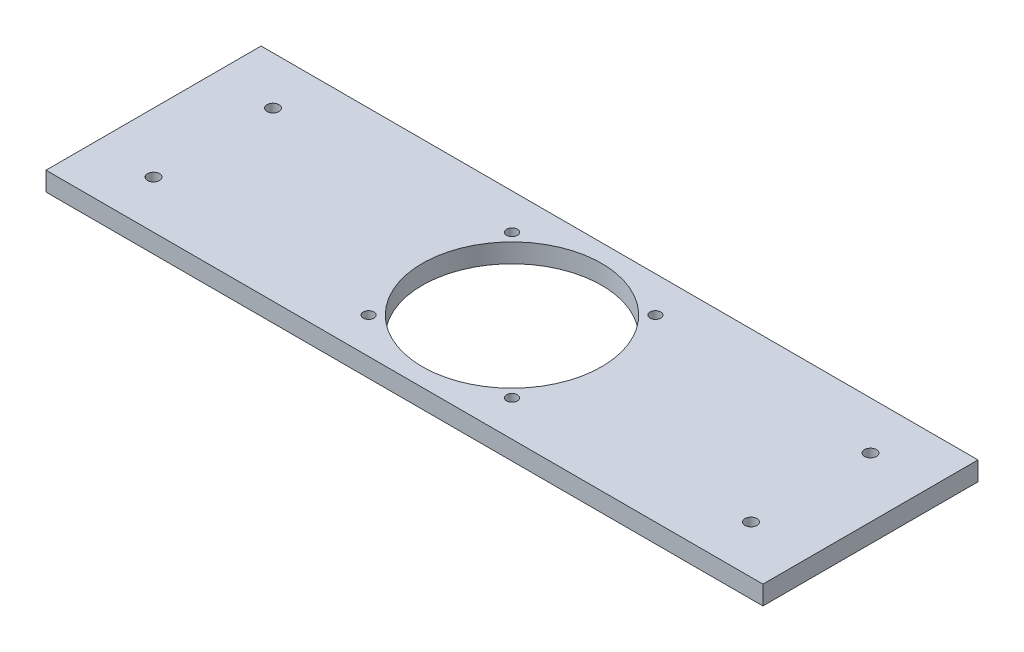
from build123d import *

# Parameters (mm, degrees)
SKETCH1_W           = 120
SKETCH1_H           = 36
BOSS_EXTRUDE1_DEPTH = 3.175
SKETCH2_R           = 15
CUT_EXTRUDE1_DEPTH  = 10
SKETCH3_R           = 0.9
CUT_EXTRUDE2_DEPTH  = 10
SKETCH4_R           = 1
CUT_EXTRUDE3_DEPTH  = 10


with BuildPart() as part:
    # Sketch1 → Boss-Extrude1 (new body)
    with BuildSketch(Plane(origin=(0, 0, 0), x_dir=(1, 0, 0), z_dir=(0, 1, 0))):
        Rectangle(SKETCH1_W, SKETCH1_H)
    extrude(amount=BOSS_EXTRUDE1_DEPTH)

    # Sketch2 → Cut-Extrude1 (cut)
    with BuildSketch(Plane(origin=(0, 3.175, 0), x_dir=(1, 0, 0), z_dir=(0, 1, 0))):
        with Locations(Location((0, 0, 0), (0, 0, 270))):
            Circle(SKETCH2_R)
    extrude(amount=-CUT_EXTRUDE1_DEPTH, mode=Mode.SUBTRACT)

    # Sketch3 → Cut-Extrude2 (cut)
    with BuildSketch(Plane(origin=(0, 3.175, 0), x_dir=(1, 0, 0), z_dir=(0, 1, 0))):
        with Locations(Location((12, 12, 0), (0, 0, 270))):
            Circle(SKETCH3_R)
        with Locations(Location((-12, 12, 0), (0, 0, 270))):
            Circle(SKETCH3_R)
        with Locations(Location((12, -12, 0), (0, 0, 270))):
            Circle(SKETCH3_R)
        with Locations(Location((-12, -12, 0), (0, 0, 270))):
            Circle(SKETCH3_R)
    extrude(amount=-CUT_EXTRUDE2_DEPTH, mode=Mode.SUBTRACT)

    # Sketch4 → Cut-Extrude3 (cut)
    with BuildSketch(Plane(origin=(0, 3.175, 0), x_dir=(1, 0, 0), z_dir=(0, 1, 0))):
        with Locations(Location((-50, 10, 0), (0, 0, 270))):
            Circle(SKETCH4_R)
        with Locations(Location((50, 10, 0), (0, 0, 270))):
            Circle(SKETCH4_R)
        with Locations(Location((50, -10, 0), (0, 0, 270))):
            Circle(SKETCH4_R)
        with Locations(Location((-50, -10, 0), (0, 0, 270))):
            Circle(SKETCH4_R)
    extrude(amount=-CUT_EXTRUDE3_DEPTH, mode=Mode.SUBTRACT)


solid = part.part
